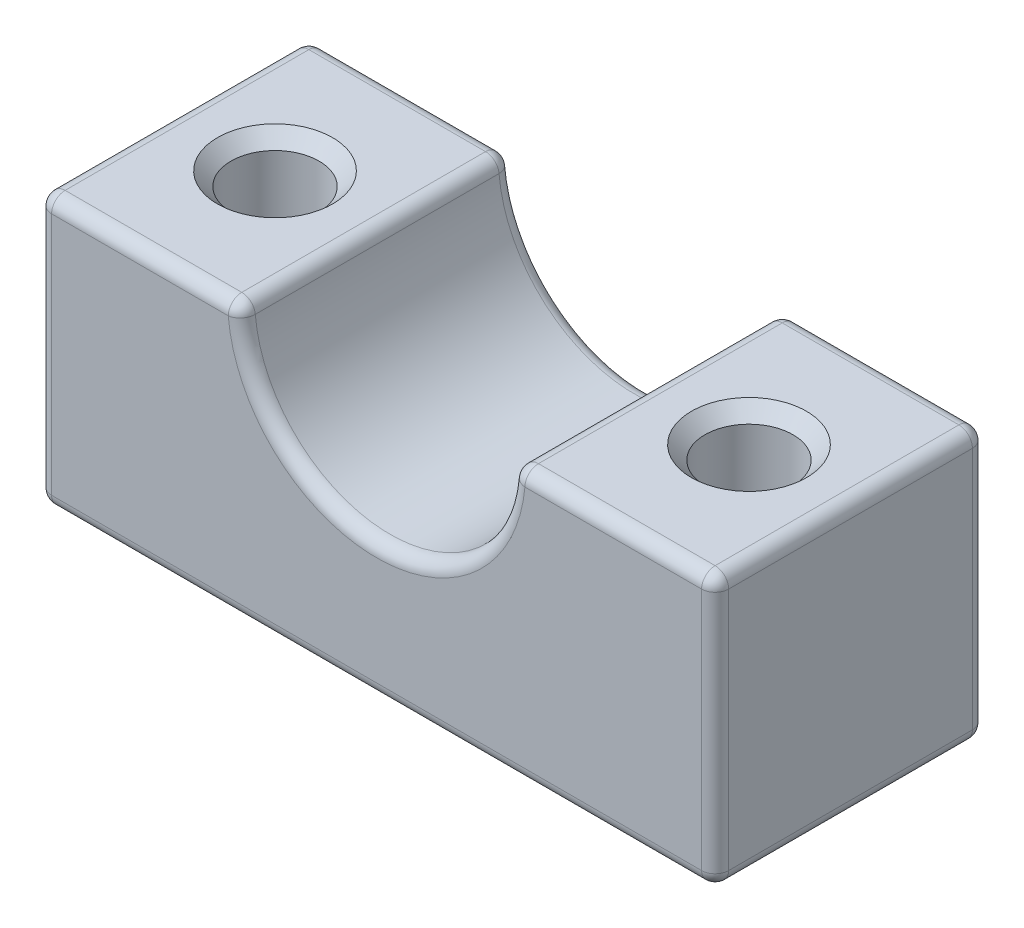
from build123d import *

# Parameters (mm, degrees)
DODANIE_WYCI_GNI_CIE1_DEPTH = 40
WYTNIJ_WYCI_GNI_CIE3_REACH  = 77.498
SZKIC2_R                    = 6.5
SZKIC3_R                    = 5
WYTNIJ_WYCI_GNI_CIE6_DEPTH  = 15
SFAZOWANIE1_SIZE            = 2
ZAOKR_GLENIE1_R             = 2


with BuildPart() as part:
    # Szkic1 → Dodanie-wyciągnięcie1 (new body)
    with BuildSketch(Plane.XY):
        with BuildLine():
            Line((50, 0), (20, 0))
            ThreePointArc((20, 0), (0, -20), (-20, 0))
            Line((-20, 0), (-50, 0))
            Line((-50, 0), (-50, -40))
            Line((-50, -40), (50, -40))
            Line((50, -40), (50, 0))
        make_face()
    extrude(amount=DODANIE_WYCI_GNI_CIE1_DEPTH)

    # Szkic2 → Wytnij-wyciągnięcie3 (cut, up to next)
    with BuildSketch(Plane(origin=(0, 0, 0), x_dir=(1, 0, 0), z_dir=(0, 1, 0)), mode=Mode.PRIVATE) as wytnij_wyci_gni_cie3_sk1:
        with Locations(Location((-35, -20, 0), (0, 0, 270))):
            Circle(SZKIC2_R)
    wytnij_wyci_gni_cie3_tool1 = extrude(wytnij_wyci_gni_cie3_sk1.sketch, amount=-WYTNIJ_WYCI_GNI_CIE3_REACH, mode=Mode.PRIVATE) & part.part
    # Szkic2 → Wytnij-wyciągnięcie3 (cut, up to next)
    with BuildSketch(Plane(origin=(0, 0, 0), x_dir=(1, 0, 0), z_dir=(0, 1, 0)), mode=Mode.PRIVATE) as wytnij_wyci_gni_cie3_sk2:
        with Locations(Location((35, -20, 0), (0, 0, 270))):
            Circle(SZKIC2_R)
    wytnij_wyci_gni_cie3_tool2 = extrude(wytnij_wyci_gni_cie3_sk2.sketch, amount=-WYTNIJ_WYCI_GNI_CIE3_REACH, mode=Mode.PRIVATE) & part.part
    add(wytnij_wyci_gni_cie3_tool1.solids().sort_by_distance((-35, 0, 20))[0], mode=Mode.SUBTRACT)
    add(wytnij_wyci_gni_cie3_tool2.solids().sort_by_distance((35, 0, 20))[0], mode=Mode.SUBTRACT)

    # Szkic3 → Wytnij-wyciągnięcie6 (cut)
    with BuildSketch(Plane(origin=(0, -40, 0), x_dir=(-1, 0, 0), z_dir=(0, -1, 0))):
        with Locations(Location((0, -30, 0), (0, 0, 90))):
            Circle(SZKIC3_R)
    extrude(amount=-WYTNIJ_WYCI_GNI_CIE6_DEPTH, mode=Mode.SUBTRACT)

    # Sfazowanie1
    sfazowanie1_edges = [part.edges().sort_by_distance(p)[0] for p in [
        (-35, 0, 13.5),
        (-35, -40, 13.5),
        (35, 0, 13.5),
        (35, -40, 13.5),
        (0, -40, 35),
    ]]
    chamfer(sfazowanie1_edges, length=SFAZOWANIE1_SIZE)

    # Zaokrąglenie1
    zaokr_glenie1_edges = [part.edges().sort_by_distance(p)[0] for p in [
        (0, -20, 0),
        (-35, 0, 40),
        (20, 0, 20),
        (50, 0, 20),
        (50, -40, 20),
        (-50, -40, 20),
        (-50, 0, 20),
        (-20, 0, 20),
        (-50, -20, 40),
        (0, -40, 40),
        (50, -20, 40),
        (35, 0, 40),
        (0, -20, 40),
        (35, 0, 0),
        (50, -20, 0),
        (0, -40, 0),
        (-50, -20, 0),
        (-35, 0, 0),
    ]]
    fillet(zaokr_glenie1_edges, radius=ZAOKR_GLENIE1_R)


solid = part.part
